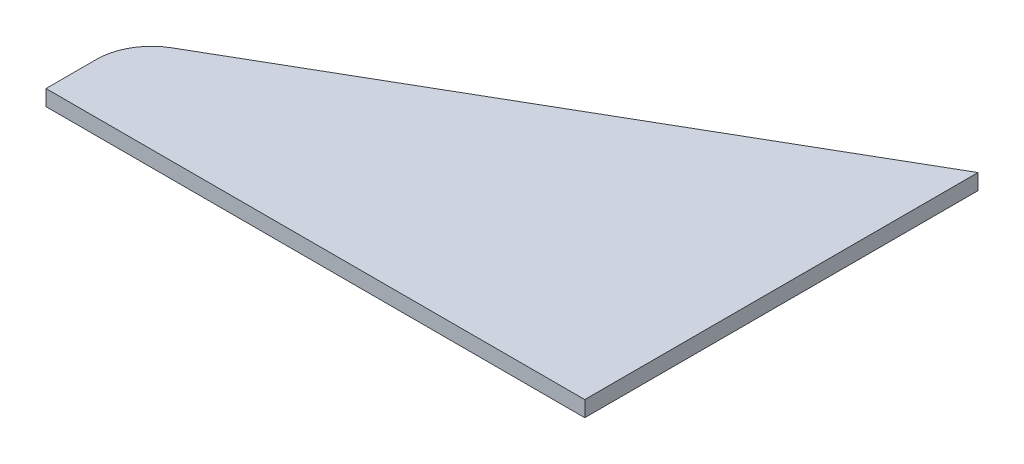
from build123d import *

# Parameters (mm, degrees)
BOSS_EXTRUDE1_DEPTH   = 6.35
BOSS_EXTRUDE1_2_DEPTH = 6.35


with BuildPart() as part:
    # Sketch1 → Boss-Extrude1 (new body)
    with BuildSketch(Plane(origin=(0, 0, 0), x_dir=(1, 0, 0), z_dir=(0, 1, 0))):
        with BuildLine():
            ThreePointArc((-26.9875, 39.599338196), (-18.852585401, 31.464423597), (-15.875, 20.351923597))
            Line((-15.875, 20.351923597), (-15.875, 0))
            Line((-15.875, 0), (-233.3625, 0))
            Line((-233.3625, 0), (-233.3625, 158.75))
            Line((-233.3625, 158.75), (-26.9875, 39.599338196))
        make_face()
    extrude(amount=BOSS_EXTRUDE1_DEPTH)


with BuildPart() as body_2:
    # Sketch1 → Boss-Extrude1 2 (new body)
    with BuildSketch(Plane(origin=(0, 0, 0), x_dir=(1, 0, 0), z_dir=(0, 1, 0))):
        with BuildLine():
            Line((233.3625, 158.75), (26.9875, 39.599338196))
            ThreePointArc((26.9875, 39.599338196), (18.852585401, 31.464423597), (15.875, 20.351923597))
            Line((15.875, 20.351923597), (15.875, 0))
            Line((15.875, 0), (233.3625, 0))
            Line((233.3625, 0), (233.3625, 158.75))
        make_face()
    extrude(amount=BOSS_EXTRUDE1_2_DEPTH)


solid = body_2.part
